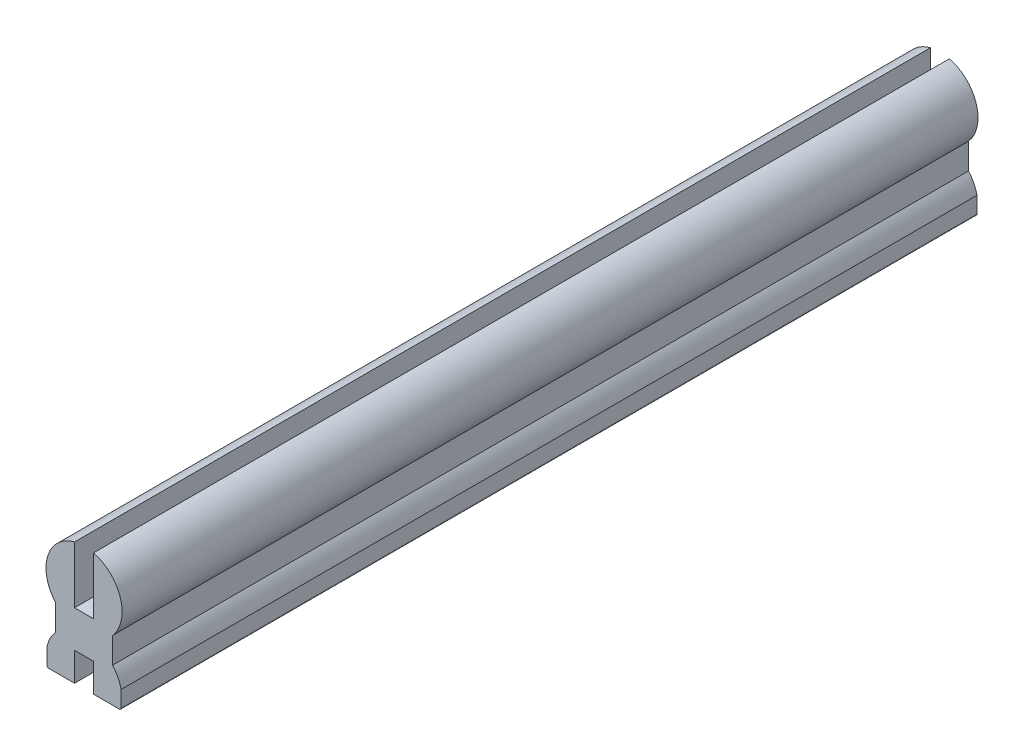
from build123d import *

# Parameters (mm, degrees)
EXTRUDE_1_DEPTH = 45
FILLET_1_R      = 0.1


with BuildPart() as part:
    # 草图1 → 凸台-拉伸1 (new body)
    with BuildSketch(Plane.XY):
        with BuildLine():
            Line((-1.95, -2.5), (-0.5, -2.5))
            Line((-0.5, -2.5), (-0.5, -1))
            Line((-0.5, -1), (0.5, -1))
            Line((0.5, -1), (0.5, -2.5))
            Line((0.5, -2.5), (1.95, -2.5))
            Line((1.95, -2.5), (1.95, -1.555590279))
            ThreePointArc((1.95, -1.555590279), (1.780042303, -1.088161527), (1.5, -0.677124344))
            Line((1.5, -0.677124344), (1.5, 0.677124344))
            ThreePointArc((1.5, 0.677124344), (1.912032648, 2.586626929), (0.5, 3.936491673))
            Line((0.5, 3.936491673), (0.5, 0.936491673))
            Line((0.5, 0.936491673), (-0.5, 0.936491673))
            Line((-0.5, 0.936491673), (-0.5, 3.936491673))
            ThreePointArc((-0.5, 3.936491673), (-1.912032648, 2.586626929), (-1.5, 0.677124344))
            Line((-1.5, 0.677124344), (-1.5, -0.677124344))
            ThreePointArc((-1.5, -0.677124344), (-1.780042303, -1.088161527), (-1.95, -1.555590279))
            Line((-1.95, -1.555590279), (-1.95, -2.5))
        make_face()
    extrude(amount=-EXTRUDE_1_DEPTH)

    # 圆角1
    fillet_1_edges = [part.edges().sort_by_distance(p)[0] for p in [
        (1.95, -2.5, -22.5),
        (-1.95, -2.5, -22.5),
    ]]
    fillet(fillet_1_edges, radius=FILLET_1_R)


solid = part.part
